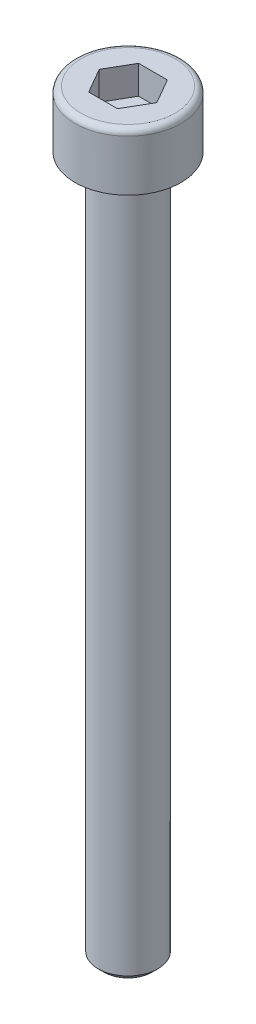
from build123d import *

# Parameters (mm, degrees)
CHAMFER1_SIZE      = 0.3
FILLET1_R          = 0.3
CUT_EXTRUDE1_DEPTH = 1.43


with BuildPart() as part:
    # Sketch1 → Revolve1 (revolve)
    with BuildSketch(Plane.XY, mode=Mode.PRIVATE) as revolve1_sk:
        Polygon((0, 0), (0, 2.86), (2.66, 2.86), (2.66, 0), (1.5, 0), (1.5, -35), (0, -35), align=None)
    revolve(revolve1_sk.sketch.rotate(Axis((0, 2.86, 0), (0, 1, 0)), 90), axis=Axis((0, 2.86, 0), (0, 1, 0)))

    # Chamfer1
    chamfer1_edges = [part.edges().sort_by_distance(p)[0] for p in [
        (0, -35, 1.5),
    ]]
    chamfer(chamfer1_edges, length=CHAMFER1_SIZE)

    # Fillet1
    fillet1_edges = [part.edges().sort_by_distance(p)[0] for p in [
        (0, 2.86, 2.66),
    ]]
    fillet(fillet1_edges, radius=FILLET1_R)

    # Sketch2 → Cut-Extrude1 (cut)
    with BuildSketch(Plane(origin=(0, 2.86, 0), x_dir=(1, 0, 0), z_dir=(0, 1, 0))):
        Polygon((0.721687836, -1.25), (1.443375673, 0), (0.721687836, 1.25), (-0.721687836, 1.25), (-1.443375673, 0), (-0.721687836, -1.25), align=None)
    extrude(amount=-CUT_EXTRUDE1_DEPTH, mode=Mode.SUBTRACT)


solid = part.part
